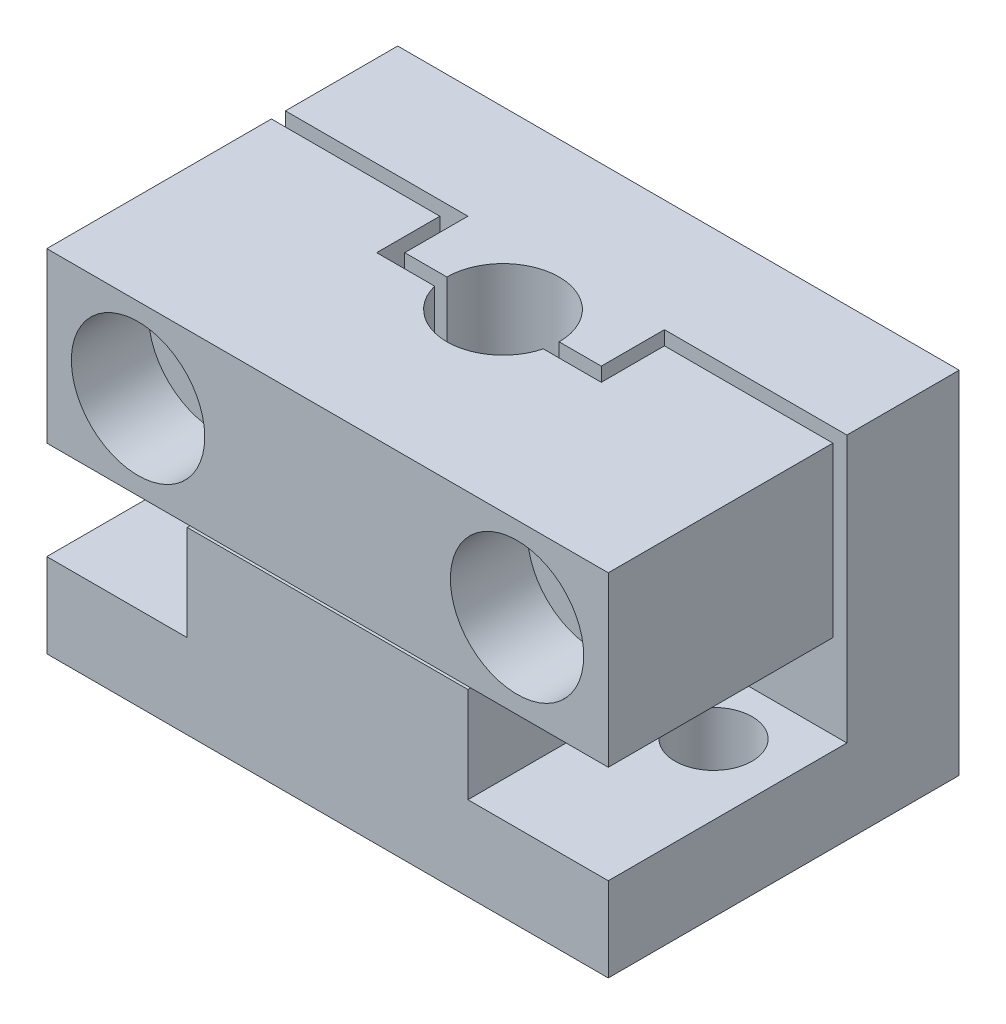
from build123d import *

# Parameters (mm, degrees)
SKETCH_2_W                = 25
SKETCH_2_H                = 25
EXTRUDE_2_DEPTH           = 20
SKETCH_8_W                = 17
SKETCH_8_H                = 7
CUT_EXTRUDE_5_DEPTH       = 10
CUT_EXTRUDE_6_DEPTH       = 12
SKETCH_13_W               = 20
SKETCH_13_H               = 0.2
CUT_EXTRUDE_7_DEPTH       = 12.5
HOLE_WIZARD_1_D           = 5.5
HOLE_WIZARD_1_DEPTH       = 16
HOLE_WIZARD_1_CBORE_D     = 9.5
HOLE_WIZARD_1_CBORE_DEPTH = 5.5
M5X0_8_1_D                = 4.2
M5X0_8_1_DEPTH            = 12.4
M5X0_8_1_TIP              = 1.2618073
SKETCH_16_R               = 4
CUT_EXTRUDE_8_DEPTH       = 35.369317712
SKETCH_17_R               = 2.75
CUT_EXTRUDE_9_DEPTH       = 6


with BuildPart() as part:
    # 草图2 → 凸台-拉伸2 (new, symmetric)
    with BuildSketch(Plane(origin=(0, 0, 0), x_dir=(0, 0, -1), z_dir=(1, 0, 0))):
        with Locations((0, 12.5)):
            Rectangle(SKETCH_2_W, SKETCH_2_H)
    extrude(amount=EXTRUDE_2_DEPTH, both=True)

    # 草图8 → 切除-拉伸5 (cut)
    with BuildSketch(Plane(origin=(20, 0, 0), x_dir=(0, 0, -1), z_dir=(1, 0, 0))):
        with Locations((-4, 9.5)):
            Rectangle(SKETCH_8_W, SKETCH_8_H)
    cut_extrude_5 = extrude(amount=-CUT_EXTRUDE_5_DEPTH, mode=Mode.SUBTRACT)

    # 镜向1: 切除-拉伸5 across plane
    add(cut_extrude_5.mirror(Plane(origin=(0, 0, 0), x_dir=(0, 0, 1), z_dir=(1, 0, 0))), mode=Mode.SUBTRACT)

    # 草图12 → 切除-拉伸6 (cut)
    with BuildSketch(Plane(origin=(0, 25, 0), x_dir=(1, 0, 0), z_dir=(0, 1, 0))):
        Polygon((-20, 4.5), (-7, 4.5), (-7, 0), (7, 0), (7, 4.5), (20, 4.5), (20, 3.5), (8, 3.5), (8, -1), (-8, -1), (-8, 3.5), (-20, 3.5), align=None)
    extrude(amount=-CUT_EXTRUDE_6_DEPTH, mode=Mode.SUBTRACT)

    # 草图13 → 切除-拉伸7 (cut)
    with BuildSketch(Plane.XY.offset(12.5)):
        with Locations((0, 12.9)):
            Rectangle(SKETCH_13_W, SKETCH_13_H)
    extrude(amount=-CUT_EXTRUDE_7_DEPTH, mode=Mode.SUBTRACT)

    # 孔1
    with Locations(Plane.XY.offset(12.5)):
        with Locations((-13.5, 19), (13.5, 19)):
            CounterBoreHole(HOLE_WIZARD_1_D / 2, HOLE_WIZARD_1_CBORE_D / 2, HOLE_WIZARD_1_CBORE_DEPTH, depth=HOLE_WIZARD_1_DEPTH)

    # M5x0.8 螺纹孔1
    with Locations(Plane.XY.offset(-4.5)):
        with Locations((-13.5, 19), (13.5, 19)):
            Hole(M5X0_8_1_D / 2, depth=M5X0_8_1_DEPTH)
            with Locations((0, 0, -(M5X0_8_1_DEPTH + M5X0_8_1_TIP / 2))):  # 118° drill point
                Cone(0, M5X0_8_1_D / 2, M5X0_8_1_TIP, mode=Mode.SUBTRACT)

    # 草图16 → 切除-拉伸8 (cut, through all)
    with BuildSketch(Plane(origin=(0, 25, 0), x_dir=(1, 0, 0), z_dir=(0, 1, 0))):
        with Locations(Location((0, 0, 0), (0, 0, 270))):
            Circle(SKETCH_16_R)
    extrude(amount=-CUT_EXTRUDE_8_DEPTH, mode=Mode.SUBTRACT)

    # 草图17 → 切除-拉伸9 (cut)
    with BuildSketch(Plane.XZ):
        with Locations(Location((-15, 0, 0), (0, 0, 270))):
            Circle(SKETCH_17_R)
        with Locations(Location((15, 0, 0), (0, 0, 270))):
            Circle(SKETCH_17_R)
    extrude(amount=-CUT_EXTRUDE_9_DEPTH, mode=Mode.SUBTRACT)


solid = part.part
